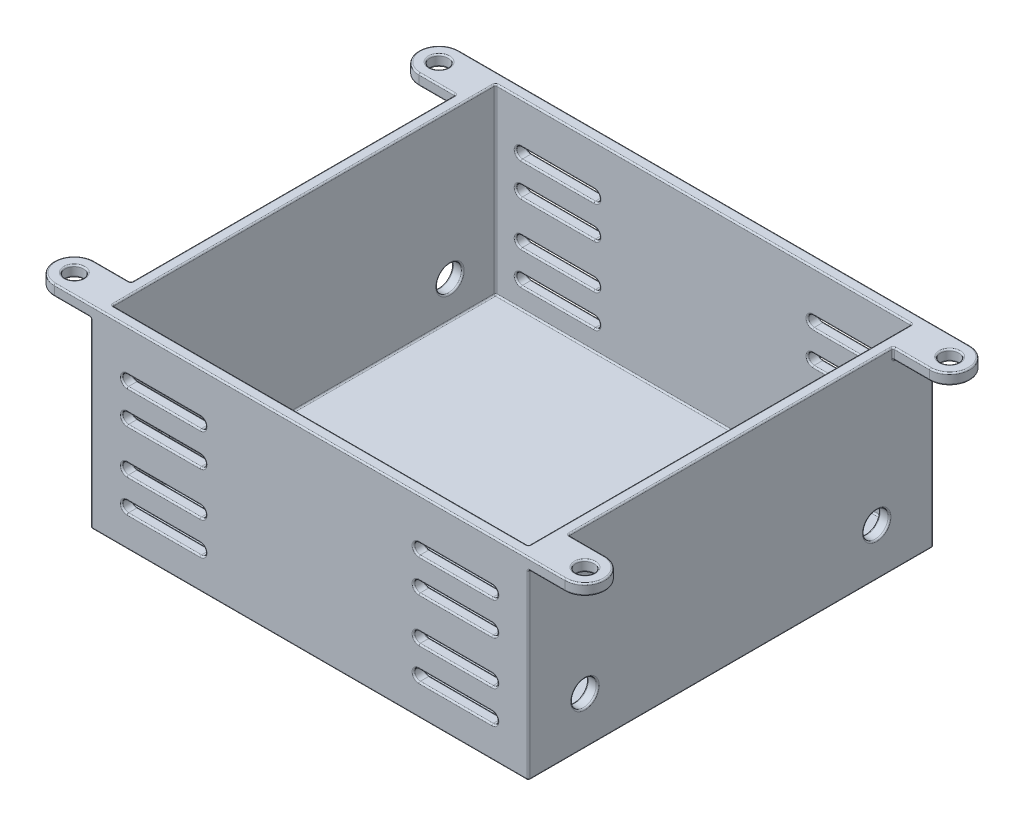
from build123d import *

# Parameters (mm, degrees)
SKETCH2_W                      = 60
SKETCH2_H                      = 55.5
SKETCH2_W_2                    = 57
SKETCH2_H_2                    = 52.5
BOSS_EXTRUDE3_DEPTH            = 25
SKETCH4_W                      = 60
SKETCH4_H                      = 55.5
BOSS_EXTRUDE4_DEPTH            = 1.5
SKETCH5_R                      = 1.25
BOSS_EXTRUDE5_DEPTH            = 1.5
CUT_EXTRUDE1_REACH             = 55.827
CUT_EXTRUDE1_DIRECTION_2_REACH = 55.827
CUT_EXTRUDE7_REACH             = 55.827
SKETCH9_R                      = 1.75
CUT_EXTRUDE7_DIRECTION_2_REACH = 55.827
FILLET1_R                      = 0.2


with BuildPart() as part:
    # Sketch2 → Boss-Extrude3 (new body)
    with BuildSketch(Plane(origin=(0, 0, 0), x_dir=(1, 0, 0), z_dir=(0, 1, 0))):
        Rectangle(SKETCH2_W, SKETCH2_H)
        Rectangle(SKETCH2_W_2, SKETCH2_H_2, mode=Mode.SUBTRACT)
    extrude(amount=-BOSS_EXTRUDE3_DEPTH)

    # Sketch4 → Boss-Extrude4 (add)
    with BuildSketch(Plane.XZ.offset(25)):
        Rectangle(SKETCH4_W, SKETCH4_H)
    extrude(amount=BOSS_EXTRUDE4_DEPTH)

    # Sketch5 → Boss-Extrude5 (add)
    # profile 1 of 4: a face of its own
    with BuildSketch(Plane(origin=(0, 0, 0), x_dir=(1, 0, 0), z_dir=(0, 1, 0))):
        with BuildLine():
            Line((-30, 22.25), (-30, 27.75))
            Line((-30, 27.75), (-35, 27.75))
            ThreePointArc((-35, 27.75), (-37.75, 25), (-35, 22.25))
            Line((-35, 22.25), (-30, 22.25))
        make_face()
        with Locations(Location((-35, 25, 0), (0, 0, 270))):
            Circle(SKETCH5_R, mode=Mode.SUBTRACT)
    # profile 2 of 4: a face of its own
    with BuildSketch(Plane(origin=(0, 0, 0), x_dir=(1, 0, 0), z_dir=(0, 1, 0))):
        with BuildLine():
            Line((35, 27.75), (30, 27.75))
            Line((30, 27.75), (30, 22.25))
            Line((30, 22.25), (35, 22.25))
            ThreePointArc((35, 22.25), (37.75, 25), (35, 27.75))
        make_face()
        with Locations(Location((35, 25, 0), (0, 0, 270))):
            Circle(SKETCH5_R, mode=Mode.SUBTRACT)
    # profile 3 of 4: a face of its own
    with BuildSketch(Plane(origin=(0, 0, 0), x_dir=(1, 0, 0), z_dir=(0, 1, 0))):
        with BuildLine():
            Line((-30, -27.75), (-30, -22.25))
            Line((-30, -22.25), (-35, -22.25))
            ThreePointArc((-35, -22.25), (-37.75, -25), (-35, -27.75))
            Line((-35, -27.75), (-30, -27.75))
        make_face()
        with Locations(Location((-35, -25, 0), (0, 0, 270))):
            Circle(SKETCH5_R, mode=Mode.SUBTRACT)
    # profile 4 of 4: a face of its own
    with BuildSketch(Plane(origin=(0, 0, 0), x_dir=(1, 0, 0), z_dir=(0, 1, 0))):
        with BuildLine():
            Line((35, -22.25), (30, -22.25))
            Line((30, -22.25), (30, -27.75))
            Line((30, -27.75), (35, -27.75))
            ThreePointArc((35, -27.75), (37.75, -25), (35, -22.25))
        make_face()
        with Locations(Location((35, -25, 0), (0, 0, 270))):
            Circle(SKETCH5_R, mode=Mode.SUBTRACT)
    extrude(amount=-BOSS_EXTRUDE5_DEPTH)

    # Cut-Extrude1: up to this face of the body (flat: up to its plane)
    cut_extrude1_end = Plane(part.part.faces().sort_by_distance((0, -13.13317757, 27.75))[0])
    # Sketch6 → Cut-Extrude1 (cut, up to the picked face)
    with BuildSketch(Plane.XY, mode=Mode.PRIVATE) as cut_extrude1_sk1:
        with BuildLine():
            Line((-25, -5.75), (-15, -5.75))
            ThreePointArc((-15, -5.75), (-14.25, -6.5), (-15, -7.25))
            Line((-15, -7.25), (-25, -7.25))
            ThreePointArc((-25, -7.25), (-25.75, -6.5), (-25, -5.75))
        make_face()
    cut_extrude1_tool1 = split(extrude(cut_extrude1_sk1.sketch, amount=CUT_EXTRUDE1_REACH, mode=Mode.PRIVATE), bisect_by=cut_extrude1_end, keep=Keep.BOTH, mode=Mode.PRIVATE)
    # Sketch6 → Cut-Extrude1 (cut, up to the picked face)
    with BuildSketch(Plane.XY, mode=Mode.PRIVATE) as cut_extrude1_sk2:
        with BuildLine():
            Line((-25, -10.25), (-15, -10.25))
            ThreePointArc((-15, -10.25), (-14.25, -11), (-15, -11.75))
            Line((-15, -11.75), (-25, -11.75))
            ThreePointArc((-25, -11.75), (-25.75, -11), (-25, -10.25))
        make_face()
    cut_extrude1_tool2 = split(extrude(cut_extrude1_sk2.sketch, amount=CUT_EXTRUDE1_REACH, mode=Mode.PRIVATE), bisect_by=cut_extrude1_end, keep=Keep.BOTH, mode=Mode.PRIVATE)
    # Sketch6 → Cut-Extrude1 (cut, up to the picked face)
    with BuildSketch(Plane.XY, mode=Mode.PRIVATE) as cut_extrude1_sk3:
        with BuildLine():
            Line((-25, -17.75), (-15, -17.75))
            ThreePointArc((-15, -17.75), (-14.25, -17), (-15, -16.25))
            Line((-15, -16.25), (-25, -16.25))
            ThreePointArc((-25, -16.25), (-25.75, -17), (-25, -17.75))
        make_face()
    cut_extrude1_tool3 = split(extrude(cut_extrude1_sk3.sketch, amount=CUT_EXTRUDE1_REACH, mode=Mode.PRIVATE), bisect_by=cut_extrude1_end, keep=Keep.BOTH, mode=Mode.PRIVATE)
    # Sketch6 → Cut-Extrude1 (cut, up to the picked face)
    with BuildSketch(Plane.XY, mode=Mode.PRIVATE) as cut_extrude1_sk4:
        with BuildLine():
            Line((-25, -22.25), (-15, -22.25))
            ThreePointArc((-15, -22.25), (-14.25, -21.5), (-15, -20.75))
            Line((-15, -20.75), (-25, -20.75))
            ThreePointArc((-25, -20.75), (-25.75, -21.5), (-25, -22.25))
        make_face()
    cut_extrude1_tool4 = split(extrude(cut_extrude1_sk4.sketch, amount=CUT_EXTRUDE1_REACH, mode=Mode.PRIVATE), bisect_by=cut_extrude1_end, keep=Keep.BOTH, mode=Mode.PRIVATE)
    # Sketch6 → Cut-Extrude1 (cut, up to the picked face)
    with BuildSketch(Plane.XY, mode=Mode.PRIVATE) as cut_extrude1_sk5:
        with BuildLine():
            Line((25, -5.75), (15, -5.75))
            ThreePointArc((15, -5.75), (14.25, -6.5), (15, -7.25))
            Line((15, -7.25), (25, -7.25))
            ThreePointArc((25, -7.25), (25.75, -6.5), (25, -5.75))
        make_face()
    cut_extrude1_tool5 = split(extrude(cut_extrude1_sk5.sketch, amount=CUT_EXTRUDE1_REACH, mode=Mode.PRIVATE), bisect_by=cut_extrude1_end, keep=Keep.BOTH, mode=Mode.PRIVATE)
    # Sketch6 → Cut-Extrude1 (cut, up to the picked face)
    with BuildSketch(Plane.XY, mode=Mode.PRIVATE) as cut_extrude1_sk6:
        with BuildLine():
            Line((25, -10.25), (15, -10.25))
            ThreePointArc((15, -10.25), (14.25, -11), (15, -11.75))
            Line((15, -11.75), (25, -11.75))
            ThreePointArc((25, -11.75), (25.75, -11), (25, -10.25))
        make_face()
    cut_extrude1_tool6 = split(extrude(cut_extrude1_sk6.sketch, amount=CUT_EXTRUDE1_REACH, mode=Mode.PRIVATE), bisect_by=cut_extrude1_end, keep=Keep.BOTH, mode=Mode.PRIVATE)
    # Sketch6 → Cut-Extrude1 (cut, up to the picked face)
    with BuildSketch(Plane.XY, mode=Mode.PRIVATE) as cut_extrude1_sk7:
        with BuildLine():
            Line((25, -17.75), (15, -17.75))
            ThreePointArc((15, -17.75), (14.25, -17), (15, -16.25))
            Line((15, -16.25), (25, -16.25))
            ThreePointArc((25, -16.25), (25.75, -17), (25, -17.75))
        make_face()
    cut_extrude1_tool7 = split(extrude(cut_extrude1_sk7.sketch, amount=CUT_EXTRUDE1_REACH, mode=Mode.PRIVATE), bisect_by=cut_extrude1_end, keep=Keep.BOTH, mode=Mode.PRIVATE)
    # Sketch6 → Cut-Extrude1 (cut, up to the picked face)
    with BuildSketch(Plane.XY, mode=Mode.PRIVATE) as cut_extrude1_sk8:
        with BuildLine():
            Line((25, -22.25), (15, -22.25))
            ThreePointArc((15, -22.25), (14.25, -21.5), (15, -20.75))
            Line((15, -20.75), (25, -20.75))
            ThreePointArc((25, -20.75), (25.75, -21.5), (25, -22.25))
        make_face()
    cut_extrude1_tool8 = split(extrude(cut_extrude1_sk8.sketch, amount=CUT_EXTRUDE1_REACH, mode=Mode.PRIVATE), bisect_by=cut_extrude1_end, keep=Keep.BOTH, mode=Mode.PRIVATE)
    add(cut_extrude1_tool1.solids().sort_by(Axis((-20, -6.5, 0), (0, 0, 1)))[0], mode=Mode.SUBTRACT)
    add(cut_extrude1_tool2.solids().sort_by(Axis((-20, -11, 0), (0, 0, 1)))[0], mode=Mode.SUBTRACT)
    add(cut_extrude1_tool3.solids().sort_by(Axis((-20, -17, 0), (0, 0, 1)))[0], mode=Mode.SUBTRACT)
    add(cut_extrude1_tool4.solids().sort_by(Axis((-20, -21.5, 0), (0, 0, 1)))[0], mode=Mode.SUBTRACT)
    add(cut_extrude1_tool5.solids().sort_by(Axis((20, -6.5, 0), (0, 0, 1)))[0], mode=Mode.SUBTRACT)
    add(cut_extrude1_tool6.solids().sort_by(Axis((20, -11, 0), (0, 0, 1)))[0], mode=Mode.SUBTRACT)
    add(cut_extrude1_tool7.solids().sort_by(Axis((20, -17, 0), (0, 0, 1)))[0], mode=Mode.SUBTRACT)
    add(cut_extrude1_tool8.solids().sort_by(Axis((20, -21.5, 0), (0, 0, 1)))[0], mode=Mode.SUBTRACT)

    # Cut-Extrude1 direction 2: up to this face of the body (flat: up to its plane)
    cut_extrude1_direction_2_end = Plane(part.part.faces().sort_by_distance((0, -13.13317757, -27.75))[0])
    # Sketch6 → Cut-Extrude1 direction 2 (cut, up to the picked face)
    with BuildSketch(Plane.XY, mode=Mode.PRIVATE) as cut_extrude1_direction_2_sk1:
        with BuildLine():
            Line((-25, -5.75), (-15, -5.75))
            ThreePointArc((-15, -5.75), (-14.25, -6.5), (-15, -7.25))
            Line((-15, -7.25), (-25, -7.25))
            ThreePointArc((-25, -7.25), (-25.75, -6.5), (-25, -5.75))
        make_face()
    cut_extrude1_direction_2_tool1 = split(extrude(cut_extrude1_direction_2_sk1.sketch, amount=-CUT_EXTRUDE1_DIRECTION_2_REACH, mode=Mode.PRIVATE), bisect_by=cut_extrude1_direction_2_end, keep=Keep.BOTH, mode=Mode.PRIVATE)
    # Sketch6 → Cut-Extrude1 direction 2 (cut, up to the picked face)
    with BuildSketch(Plane.XY, mode=Mode.PRIVATE) as cut_extrude1_direction_2_sk2:
        with BuildLine():
            Line((-25, -10.25), (-15, -10.25))
            ThreePointArc((-15, -10.25), (-14.25, -11), (-15, -11.75))
            Line((-15, -11.75), (-25, -11.75))
            ThreePointArc((-25, -11.75), (-25.75, -11), (-25, -10.25))
        make_face()
    cut_extrude1_direction_2_tool2 = split(extrude(cut_extrude1_direction_2_sk2.sketch, amount=-CUT_EXTRUDE1_DIRECTION_2_REACH, mode=Mode.PRIVATE), bisect_by=cut_extrude1_direction_2_end, keep=Keep.BOTH, mode=Mode.PRIVATE)
    # Sketch6 → Cut-Extrude1 direction 2 (cut, up to the picked face)
    with BuildSketch(Plane.XY, mode=Mode.PRIVATE) as cut_extrude1_direction_2_sk3:
        with BuildLine():
            Line((-25, -17.75), (-15, -17.75))
            ThreePointArc((-15, -17.75), (-14.25, -17), (-15, -16.25))
            Line((-15, -16.25), (-25, -16.25))
            ThreePointArc((-25, -16.25), (-25.75, -17), (-25, -17.75))
        make_face()
    cut_extrude1_direction_2_tool3 = split(extrude(cut_extrude1_direction_2_sk3.sketch, amount=-CUT_EXTRUDE1_DIRECTION_2_REACH, mode=Mode.PRIVATE), bisect_by=cut_extrude1_direction_2_end, keep=Keep.BOTH, mode=Mode.PRIVATE)
    # Sketch6 → Cut-Extrude1 direction 2 (cut, up to the picked face)
    with BuildSketch(Plane.XY, mode=Mode.PRIVATE) as cut_extrude1_direction_2_sk4:
        with BuildLine():
            Line((-25, -22.25), (-15, -22.25))
            ThreePointArc((-15, -22.25), (-14.25, -21.5), (-15, -20.75))
            Line((-15, -20.75), (-25, -20.75))
            ThreePointArc((-25, -20.75), (-25.75, -21.5), (-25, -22.25))
        make_face()
    cut_extrude1_direction_2_tool4 = split(extrude(cut_extrude1_direction_2_sk4.sketch, amount=-CUT_EXTRUDE1_DIRECTION_2_REACH, mode=Mode.PRIVATE), bisect_by=cut_extrude1_direction_2_end, keep=Keep.BOTH, mode=Mode.PRIVATE)
    # Sketch6 → Cut-Extrude1 direction 2 (cut, up to the picked face)
    with BuildSketch(Plane.XY, mode=Mode.PRIVATE) as cut_extrude1_direction_2_sk5:
        with BuildLine():
            Line((25, -5.75), (15, -5.75))
            ThreePointArc((15, -5.75), (14.25, -6.5), (15, -7.25))
            Line((15, -7.25), (25, -7.25))
            ThreePointArc((25, -7.25), (25.75, -6.5), (25, -5.75))
        make_face()
    cut_extrude1_direction_2_tool5 = split(extrude(cut_extrude1_direction_2_sk5.sketch, amount=-CUT_EXTRUDE1_DIRECTION_2_REACH, mode=Mode.PRIVATE), bisect_by=cut_extrude1_direction_2_end, keep=Keep.BOTH, mode=Mode.PRIVATE)
    # Sketch6 → Cut-Extrude1 direction 2 (cut, up to the picked face)
    with BuildSketch(Plane.XY, mode=Mode.PRIVATE) as cut_extrude1_direction_2_sk6:
        with BuildLine():
            Line((25, -10.25), (15, -10.25))
            ThreePointArc((15, -10.25), (14.25, -11), (15, -11.75))
            Line((15, -11.75), (25, -11.75))
            ThreePointArc((25, -11.75), (25.75, -11), (25, -10.25))
        make_face()
    cut_extrude1_direction_2_tool6 = split(extrude(cut_extrude1_direction_2_sk6.sketch, amount=-CUT_EXTRUDE1_DIRECTION_2_REACH, mode=Mode.PRIVATE), bisect_by=cut_extrude1_direction_2_end, keep=Keep.BOTH, mode=Mode.PRIVATE)
    # Sketch6 → Cut-Extrude1 direction 2 (cut, up to the picked face)
    with BuildSketch(Plane.XY, mode=Mode.PRIVATE) as cut_extrude1_direction_2_sk7:
        with BuildLine():
            Line((25, -17.75), (15, -17.75))
            ThreePointArc((15, -17.75), (14.25, -17), (15, -16.25))
            Line((15, -16.25), (25, -16.25))
            ThreePointArc((25, -16.25), (25.75, -17), (25, -17.75))
        make_face()
    cut_extrude1_direction_2_tool7 = split(extrude(cut_extrude1_direction_2_sk7.sketch, amount=-CUT_EXTRUDE1_DIRECTION_2_REACH, mode=Mode.PRIVATE), bisect_by=cut_extrude1_direction_2_end, keep=Keep.BOTH, mode=Mode.PRIVATE)
    # Sketch6 → Cut-Extrude1 direction 2 (cut, up to the picked face)
    with BuildSketch(Plane.XY, mode=Mode.PRIVATE) as cut_extrude1_direction_2_sk8:
        with BuildLine():
            Line((25, -22.25), (15, -22.25))
            ThreePointArc((15, -22.25), (14.25, -21.5), (15, -20.75))
            Line((15, -20.75), (25, -20.75))
            ThreePointArc((25, -20.75), (25.75, -21.5), (25, -22.25))
        make_face()
    cut_extrude1_direction_2_tool8 = split(extrude(cut_extrude1_direction_2_sk8.sketch, amount=-CUT_EXTRUDE1_DIRECTION_2_REACH, mode=Mode.PRIVATE), bisect_by=cut_extrude1_direction_2_end, keep=Keep.BOTH, mode=Mode.PRIVATE)
    add(cut_extrude1_direction_2_tool1.solids().sort_by(Axis((-20, -6.5, 0), (0, 0, -1)))[0], mode=Mode.SUBTRACT)
    add(cut_extrude1_direction_2_tool2.solids().sort_by(Axis((-20, -11, 0), (0, 0, -1)))[0], mode=Mode.SUBTRACT)
    add(cut_extrude1_direction_2_tool3.solids().sort_by(Axis((-20, -17, 0), (0, 0, -1)))[0], mode=Mode.SUBTRACT)
    add(cut_extrude1_direction_2_tool4.solids().sort_by(Axis((-20, -21.5, 0), (0, 0, -1)))[0], mode=Mode.SUBTRACT)
    add(cut_extrude1_direction_2_tool5.solids().sort_by(Axis((20, -6.5, 0), (0, 0, -1)))[0], mode=Mode.SUBTRACT)
    add(cut_extrude1_direction_2_tool6.solids().sort_by(Axis((20, -11, 0), (0, 0, -1)))[0], mode=Mode.SUBTRACT)
    add(cut_extrude1_direction_2_tool7.solids().sort_by(Axis((20, -17, 0), (0, 0, -1)))[0], mode=Mode.SUBTRACT)
    add(cut_extrude1_direction_2_tool8.solids().sort_by(Axis((20, -21.5, 0), (0, 0, -1)))[0], mode=Mode.SUBTRACT)

    # Cut-Extrude7: up to this face of the body (flat: up to its plane)
    cut_extrude7_end = Plane(part.part.faces().sort_by_distance((30, -13.391825683, 0))[0])
    # Sketch9 → Cut-Extrude7 (cut, up to the picked face)
    with BuildSketch(Plane(origin=(0, 0, 0), x_dir=(0, 0, -1), z_dir=(1, 0, 0)), mode=Mode.PRIVATE) as cut_extrude7_sk1:
        with Locations(Location((-20, -20, 0), (0, 0, 180))):
            Circle(SKETCH9_R)
    cut_extrude7_tool1 = split(extrude(cut_extrude7_sk1.sketch, amount=CUT_EXTRUDE7_REACH, mode=Mode.PRIVATE), bisect_by=cut_extrude7_end, keep=Keep.BOTH, mode=Mode.PRIVATE)
    # Sketch9 → Cut-Extrude7 (cut, up to the picked face)
    with BuildSketch(Plane(origin=(0, 0, 0), x_dir=(0, 0, -1), z_dir=(1, 0, 0)), mode=Mode.PRIVATE) as cut_extrude7_sk2:
        with Locations(Location((20, -20, 0), (0, 0, 180))):
            Circle(SKETCH9_R)
    cut_extrude7_tool2 = split(extrude(cut_extrude7_sk2.sketch, amount=CUT_EXTRUDE7_REACH, mode=Mode.PRIVATE), bisect_by=cut_extrude7_end, keep=Keep.BOTH, mode=Mode.PRIVATE)
    add(cut_extrude7_tool1.solids().sort_by(Axis((0, -20, 20), (1, 0, 0)))[0], mode=Mode.SUBTRACT)
    add(cut_extrude7_tool2.solids().sort_by(Axis((0, -20, -20), (1, 0, 0)))[0], mode=Mode.SUBTRACT)

    # Cut-Extrude7 direction 2: up to this face of the body (flat: up to its plane)
    cut_extrude7_direction_2_end = Plane(part.part.faces().sort_by_distance((-30, -13.391825683, 0))[0])
    # Sketch9 → Cut-Extrude7 direction 2 (cut, up to the picked face)
    with BuildSketch(Plane(origin=(0, 0, 0), x_dir=(0, 0, -1), z_dir=(1, 0, 0)), mode=Mode.PRIVATE) as cut_extrude7_direction_2_sk1:
        with Locations(Location((-20, -20, 0), (0, 0, 180))):
            Circle(SKETCH9_R)
    cut_extrude7_direction_2_tool1 = split(extrude(cut_extrude7_direction_2_sk1.sketch, amount=-CUT_EXTRUDE7_DIRECTION_2_REACH, mode=Mode.PRIVATE), bisect_by=cut_extrude7_direction_2_end, keep=Keep.BOTH, mode=Mode.PRIVATE)
    # Sketch9 → Cut-Extrude7 direction 2 (cut, up to the picked face)
    with BuildSketch(Plane(origin=(0, 0, 0), x_dir=(0, 0, -1), z_dir=(1, 0, 0)), mode=Mode.PRIVATE) as cut_extrude7_direction_2_sk2:
        with Locations(Location((20, -20, 0), (0, 0, 180))):
            Circle(SKETCH9_R)
    cut_extrude7_direction_2_tool2 = split(extrude(cut_extrude7_direction_2_sk2.sketch, amount=-CUT_EXTRUDE7_DIRECTION_2_REACH, mode=Mode.PRIVATE), bisect_by=cut_extrude7_direction_2_end, keep=Keep.BOTH, mode=Mode.PRIVATE)
    add(cut_extrude7_direction_2_tool1.solids().sort_by(Axis((0, -20, 20), (-1, 0, 0)))[0], mode=Mode.SUBTRACT)
    add(cut_extrude7_direction_2_tool2.solids().sort_by(Axis((0, -20, -20), (-1, 0, 0)))[0], mode=Mode.SUBTRACT)

    # Fillet1
    fillet1_edges = [part.edges().sort_by_distance(p)[0] for p in [
        (-20, -5.75, 26.25),
        (-14.25, -6.5, 26.25),
        (-20, -7.25, 26.25),
        (-25.75, -6.5, 26.25),
        (20, -22.25, 26.25),
        (14.25, -21.5, 26.25),
        (20, -20.75, 26.25),
        (25.75, -21.5, 26.25),
        (20, -17.75, 26.25),
        (14.25, -17, 26.25),
        (20, -16.25, 26.25),
        (25.75, -17, 26.25),
        (20, -11.75, 26.25),
        (14.25, -11, 26.25),
        (20, -10.25, 26.25),
        (25.75, -11, 26.25),
        (-20, -10.25, 26.25),
        (-14.25, -11, 26.25),
        (-20, -11.75, 26.25),
        (-25.75, -11, 26.25),
        (-20, -16.25, 26.25),
        (-14.25, -17, 26.25),
        (-20, -17.75, 26.25),
        (-25.75, -17, 26.25),
        (-20, -20.75, 26.25),
        (-14.25, -21.5, 26.25),
        (-20, -22.25, 26.25),
        (-25.75, -21.5, 26.25),
        (20, -7.25, 26.25),
        (14.25, -6.5, 26.25),
        (20, -5.75, 26.25),
        (25.75, -6.5, 26.25),
        (0, -25, -26.25),
        (-28.5, -12.5, -26.25),
        (28.5, -25, 0),
        (28.5, -12.5, -26.25),
        (0, -25, 26.25),
        (28.5, -12.5, 26.25),
        (-28.5, -25, 0),
        (-28.5, -12.5, 26.25),
        (0, 0, -26.25),
        (-28.5, 0, 0),
        (25.75, -6.5, -27.75),
        (20, -5.75, -27.75),
        (14.25, -6.5, -27.75),
        (0, 0, 26.25),
        (20, -7.25, -27.75),
        (25.75, -6.5, -26.25),
        (20, -5.75, -26.25),
        (14.25, -6.5, -26.25),
        (20, -7.25, -26.25),
        (20, -7.25, 27.75),
        (25.75, -6.5, 27.75),
        (20, -5.75, 27.75),
        (14.25, -6.5, 27.75),
        (28.5, 0, 0),
        (-25.75, -21.5, -27.75),
        (-20, -22.25, -27.75),
        (-14.25, -21.5, -27.75),
        (-20, -20.75, -27.75),
        (-25.75, -21.5, -26.25),
        (-20, -22.25, -26.25),
        (-14.25, -21.5, -26.25),
        (-20, -20.75, -26.25),
        (-20, -20.75, 27.75),
        (-25.75, -21.5, 27.75),
        (-20, -22.25, 27.75),
        (-14.25, -21.5, 27.75),
        (-25.75, -17, -27.75),
        (-20, -17.75, -27.75),
        (-14.25, -17, -27.75),
        (-20, -16.25, -27.75),
        (-25.75, -17, -26.25),
        (-20, -17.75, -26.25),
        (-14.25, -17, -26.25),
        (-20, -16.25, -26.25),
        (-20, -16.25, 27.75),
        (-25.75, -17, 27.75),
        (-20, -17.75, 27.75),
        (-14.25, -17, 27.75),
        (-25.75, -11, -27.75),
        (-20, -11.75, -27.75),
        (-14.25, -11, -27.75),
        (-20, -10.25, -27.75),
        (-25.75, -11, -26.25),
        (-20, -11.75, -26.25),
        (-14.25, -11, -26.25),
        (-20, -10.25, -26.25),
        (-20, -10.25, 27.75),
        (-25.75, -11, 27.75),
        (-20, -11.75, 27.75),
        (-14.25, -11, 27.75),
        (25.75, -11, -27.75),
        (20, -10.25, -27.75),
        (14.25, -11, -27.75),
        (20, -11.75, -27.75),
        (25.75, -11, -26.25),
        (20, -10.25, -26.25),
        (14.25, -11, -26.25),
        (20, -11.75, -26.25),
        (20, -11.75, 27.75),
        (25.75, -11, 27.75),
        (20, -10.25, 27.75),
        (14.25, -11, 27.75),
        (25.75, -17, -27.75),
        (20, -16.25, -27.75),
        (14.25, -17, -27.75),
        (20, -17.75, -27.75),
        (25.75, -17, -26.25),
        (20, -16.25, -26.25),
        (14.25, -17, -26.25),
        (20, -17.75, -26.25),
        (20, -17.75, 27.75),
        (25.75, -17, 27.75),
        (20, -16.25, 27.75),
        (14.25, -17, 27.75),
        (25.75, -21.5, -27.75),
        (20, -20.75, -27.75),
        (14.25, -21.5, -27.75),
        (20, -22.25, -27.75),
        (25.75, -21.5, -26.25),
        (20, -20.75, -26.25),
        (14.25, -21.5, -26.25),
        (20, -22.25, -26.25),
        (20, -22.25, 27.75),
        (25.75, -21.5, 27.75),
        (20, -20.75, 27.75),
        (14.25, -21.5, 27.75),
        (-25.75, -6.5, -27.75),
        (-20, -7.25, -27.75),
        (-14.25, -6.5, -27.75),
        (-20, -5.75, -27.75),
        (-25.75, -6.5, -26.25),
        (-20, -7.25, -26.25),
        (-14.25, -6.5, -26.25),
        (-20, -5.75, -26.25),
        (-20, -5.75, 27.75),
        (-25.75, -6.5, 27.75),
        (-20, -7.25, 27.75),
        (-14.25, -6.5, 27.75),
        (0, -26.5, 27.75),
        (-30, -26.5, 0),
        (0, -26.5, -27.75),
        (30, -26.5, 0),
        (-30, -20, 18.25),
        (28.5, -20, 18.25),
        (-28.5, -20, 18.25),
        (30, -20, 18.25),
        (-30, -20, -21.75),
        (28.5, -20, -21.75),
        (-28.5, -20, -21.75),
        (30, -20, -21.75),
        (30, 0, 0),
        (32.5, -1.5, 27.75),
        (32.5, -1.5, 22.25),
        (30, -0.75, 22.25),
        (30, -1.5, 25),
        (35, -1.5, 23.75),
        (37.75, 0, 25),
        (32.5, 0, 22.25),
        (37.75, -1.5, 25),
        (0, 0, -27.75),
        (35, 0, 23.75),
        (0, 0, 27.75),
        (-30, 0, 0),
        (-32.5, -1.5, -22.25),
        (-30, -0.75, -22.25),
        (-32.5, -1.5, -27.75),
        (-30, -1.5, -25),
        (-35, -1.5, -26.25),
        (-37.75, 0, -25),
        (-32.5, 0, -22.25),
        (-37.75, -1.5, -25),
        (-35, 0, -26.25),
        (32.5, 0, -22.25),
        (30, -0.75, -22.25),
        (32.5, -1.5, -27.75),
        (32.5, -1.5, -22.25),
        (30, -1.5, -25),
        (35, -1.5, -26.25),
        (37.75, 0, -25),
        (37.75, -1.5, -25),
        (35, 0, -26.25),
        (-30, -14, -27.75),
        (30, -14, -27.75),
        (30, -14, 27.75),
        (-30, -14, 27.75),
        (-32.5, 0, 22.25),
        (-30, -0.75, 22.25),
        (-32.5, -1.5, 27.75),
        (-32.5, -1.5, 22.25),
        (-30, -1.5, 25),
        (-35, -1.5, 23.75),
        (-37.75, 0, 25),
        (-37.75, -1.5, 25),
        (-35, 0, 23.75),
    ]]
    fillet(fillet1_edges, radius=FILLET1_R)


solid = part.part
